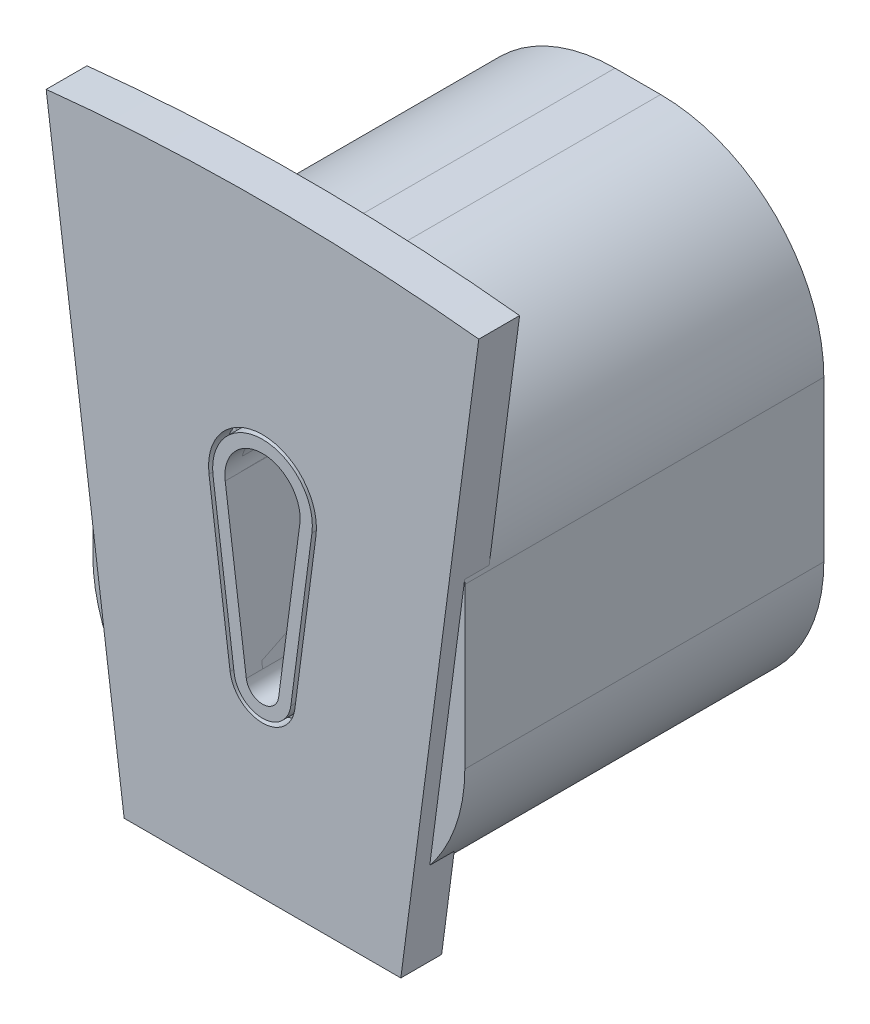
from build123d import *

# Parameters (mm, degrees)
BOSS_EXTRUDE1_DEPTH = 2.5
BOSS_EXTRUDE2_DEPTH = 1
BOSS_EXTRUDE3_DEPTH = 22
BOSS_EXTRUDE4_START = -23
BOSS_EXTRUDE4_DEPTH = 1
BOSS_EXTRUDE5_DEPTH = 22


with BuildPart() as part:
    # Sketch2 → Boss-Extrude1 (new body)
    with BuildSketch(Plane.XY):
        with BuildLine():
            Line((-8.478043415, 88), (8.478043415, 88))
            Line((8.478043415, 88), (13.2563821, 124.295085718))
            ThreePointArc((13.2563821, 124.295085718), (0, 125), (-13.2563821, 124.295085718))
            Line((-13.2563821, 124.295085718), (-8.478043415, 88))
        make_face()
        with BuildLine():
            Line((-3.276984948, 108.863662465), (-1.982889723, 99.034033333))
            ThreePointArc((-1.982889723, 99.034033333), (0, 97.295085718), (1.982889723, 99.034033333))
            Line((1.982889723, 99.034033333), (3.276984948, 108.863662465))
            ThreePointArc((3.276984948, 108.863662465), (0, 112.60034764), (-3.276984948, 108.863662465))
        make_face(mode=Mode.SUBTRACT)
    extrude(amount=BOSS_EXTRUDE1_DEPTH)


with BuildPart() as body_2:
    # Sketch4 → Boss-Extrude2 (new body)
    with BuildSketch(Plane.XY.offset(2.5)):
        with BuildLine():
            Line((-3.029123733, 108.896294013), (-1.735028507, 99.066664882))
            ThreePointArc((-1.735028507, 99.066664882), (0, 97.545085718), (1.735028507, 99.066664882))
            Line((1.735028507, 99.066664882), (3.029123733, 108.896294013))
            ThreePointArc((3.029123733, 108.896294013), (0, 112.35034764), (-3.029123733, 108.896294013))
        make_face()
        with BuildLine():
            Line((0.991444861, 99.164559526), (2.285540087, 108.994188657))
            ThreePointArc((2.285540087, 108.994188657), (0, 111.60034764), (-2.285540087, 108.994188657))
            Line((-2.285540087, 108.994188657), (-0.991444861, 99.164559526))
            ThreePointArc((-0.991444861, 99.164559526), (0, 98.295085718), (0.991444861, 99.164559526))
        make_face(mode=Mode.SUBTRACT)
    extrude(amount=-BOSS_EXTRUDE2_DEPTH)

    # Sketch6 → Boss-Extrude3 (add)
    with BuildSketch(Plane(origin=(0, 0, 1.5), x_dir=(-1, 0, 0), z_dir=(0, 0, -1))):
        with BuildLine():
            Line((2.726473369, 98.936138689), (4.020568594, 108.765767821))
            ThreePointArc((4.020568594, 108.765767821), (0, 113.35034764), (-4.020568594, 108.765767821))
            Line((-4.020568594, 108.765767821), (-2.726473369, 98.936138689))
            ThreePointArc((-2.726473369, 98.936138689), (0, 96.545085718), (2.726473369, 98.936138689))
        make_face()
        with BuildLine():
            Line((2.285540087, 108.994188657), (0.991444861, 99.164559526))
            ThreePointArc((0.991444861, 99.164559526), (0, 98.295085718), (-0.991444861, 99.164559526))
            Line((-0.991444861, 99.164559526), (-2.285540087, 108.994188657))
            ThreePointArc((-2.285540087, 108.994188657), (0, 111.60034764), (2.285540087, 108.994188657))
        make_face(mode=Mode.SUBTRACT)
    extrude(amount=BOSS_EXTRUDE3_DEPTH)

    # Sketch7 → Boss-Extrude4 (add)
    with BuildSketch(Plane.XY.offset(2.5).offset(BOSS_EXTRUDE4_START)):
        with BuildLine():
            Line((1.735028507, 99.066664882), (3.029123733, 108.896294013))
            ThreePointArc((3.029123733, 108.896294013), (0, 112.35034764), (-3.029123733, 108.896294013))
            Line((-3.029123733, 108.896294013), (-1.735028507, 99.066664882))
            ThreePointArc((-1.735028507, 99.066664882), (0, 97.545085718), (1.735028507, 99.066664882))
        make_face()
        with BuildLine():
            Line((0.991444861, 99.164559526), (2.285540087, 108.994188657))
            ThreePointArc((2.285540087, 108.994188657), (0, 111.60034764), (-2.285540087, 108.994188657))
            Line((-2.285540087, 108.994188657), (-0.991444861, 99.164559526))
            ThreePointArc((-0.991444861, 99.164559526), (0, 98.295085718), (0.991444861, 99.164559526))
        make_face(mode=Mode.SUBTRACT)
    extrude(amount=-BOSS_EXTRUDE4_DEPTH)


with BuildPart() as body_3:
    # Sketch9 → Boss-Extrude5 (new body)
    with BuildSketch(Plane.XY.offset(1.5)):
        with BuildLine():
            Line((-1.4, 119.847716679), (1.4, 119.847716679))
            ThreePointArc((1.4, 119.847716679), (8.471067812, 116.918784491), (11.4, 109.847716679))
            Line((11.4, 109.847716679), (11.4, 100.047716679))
            ThreePointArc((11.4, 100.047716679), (8.471067812, 92.976648867), (1.4, 90.047716679))
            Line((1.4, 90.047716679), (-1.4, 90.047716679))
            ThreePointArc((-1.4, 90.047716679), (-8.471067812, 92.976648867), (-11.4, 100.047716679))
            Line((-11.4, 100.047716679), (-11.4, 109.847716679))
            ThreePointArc((-11.4, 109.847716679), (-8.471067812, 116.918784491), (-1.4, 119.847716679))
        make_face()
        with BuildLine():
            Line((0.991444861, 99.164559526), (2.285540087, 108.994188657))
            ThreePointArc((2.285540087, 108.994188657), (0, 111.60034764), (-2.285540087, 108.994188657))
            Line((-2.285540087, 108.994188657), (-0.991444861, 99.164559526))
            ThreePointArc((-0.991444861, 99.164559526), (0, 98.295085718), (0.991444861, 99.164559526))
        make_face(mode=Mode.SUBTRACT)
    extrude(amount=-BOSS_EXTRUDE5_DEPTH)


solid = Compound([part.part, body_2.part, body_3.part])
